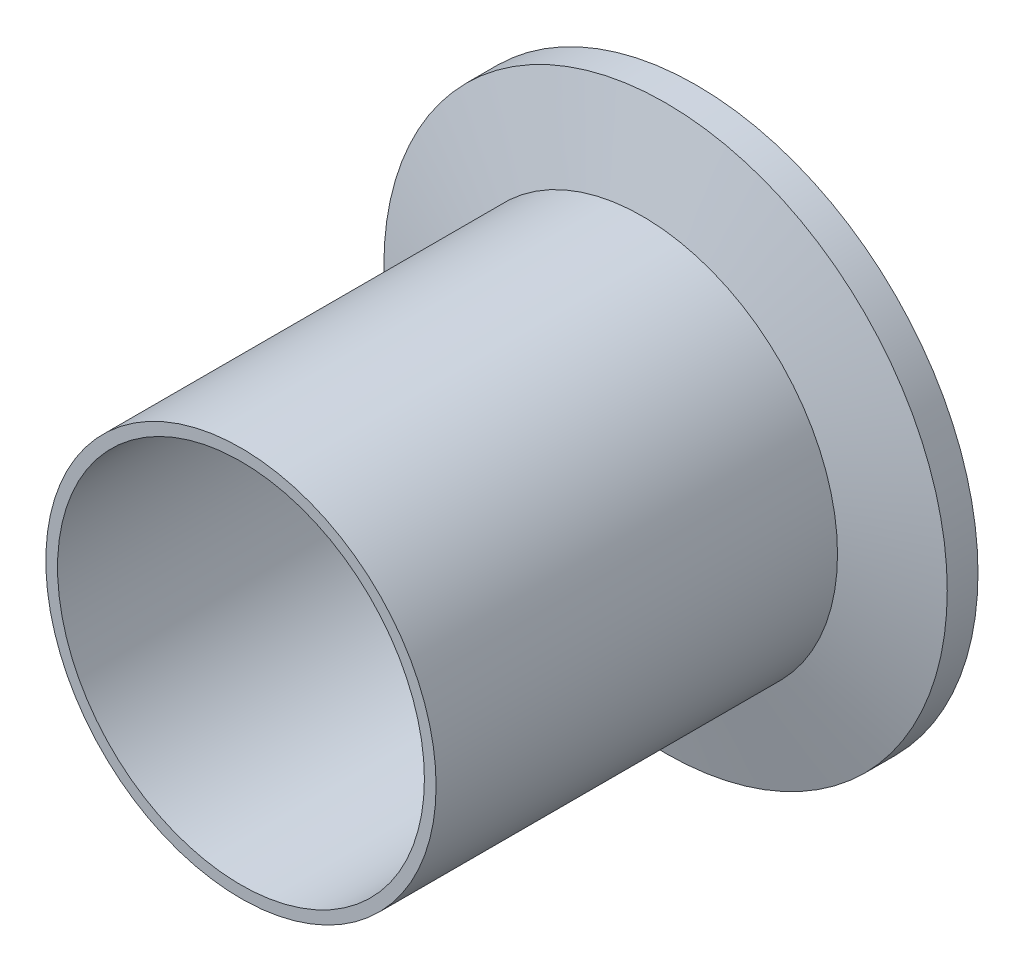
from build123d import *


with BuildPart() as part:
    # Sketch1 → Revolve1 (revolve)
    with BuildSketch(Plane(origin=(0, 0, 0), x_dir=(0, 0, -1), z_dir=(1, 0, 0)), mode=Mode.PRIVATE) as revolve1_sk:
        Polygon((-3, 27.5), (0, 27.5), (0, 20.6), (-2.5, 20.6), (-2.5, 17.907), (-44.45, 17.907), (-44.45, 19.05), (-5.264170676, 19.05), align=None)
    revolve(revolve1_sk.sketch.rotate(Axis((0, 0, 2.83330445), (0, 0, -1)), 90), axis=Axis((0, 0, 2.83330445), (0, 0, -1)))


solid = part.part
